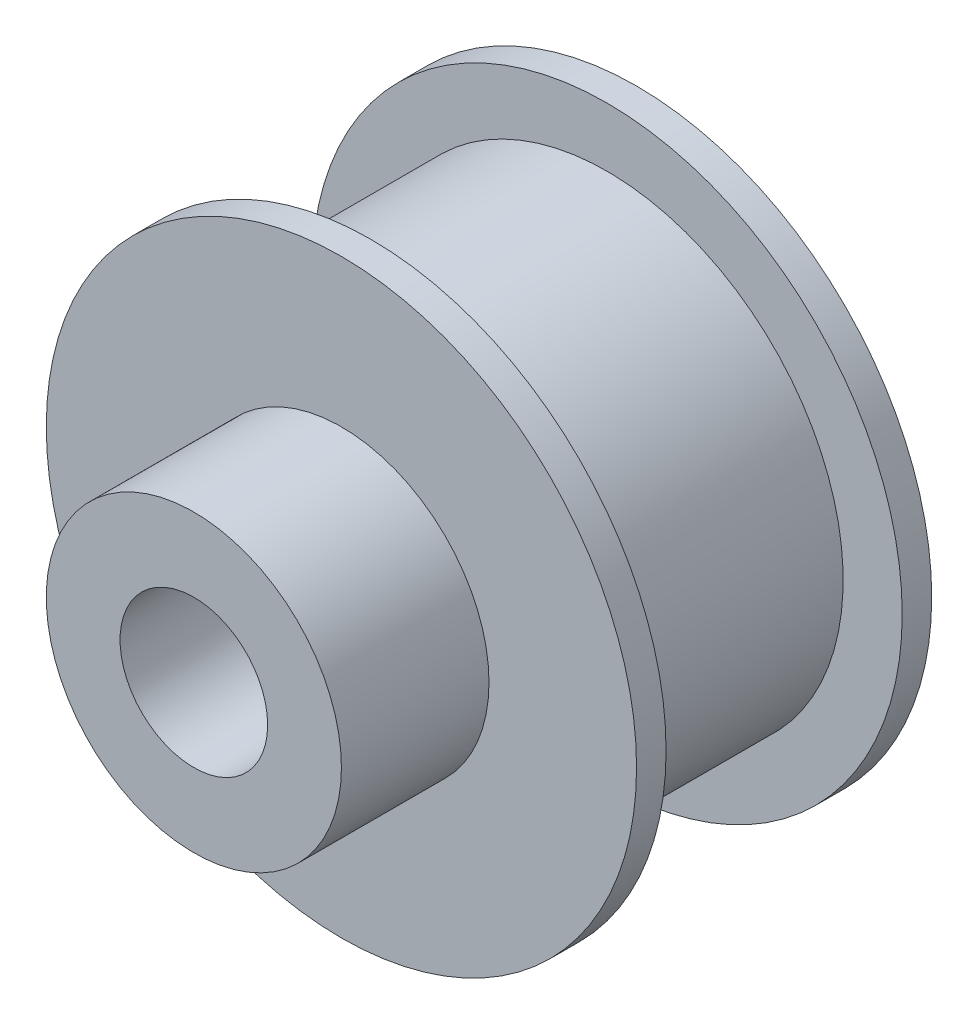
from build123d import *

# Parameters (mm, degrees)
ESQUISSE1_R             = 10
BOSS_EXTRU_1_DEPTH      = 10
ESQUISSE2_R             = 5
BOSS_EXTRU_2_DEPTH      = 5
ESQUISSE3_R             = 2.5
ENL_V_MAT_EXTRU_1_DEPTH = 21.615528128
ESQUISSE4_W             = 8
ESQUISSE4_H             = 2


with BuildPart() as part:
    # Esquisse1 → Boss.-Extru.1 (new body)
    with BuildSketch(Plane.XY):
        Circle(ESQUISSE1_R)
    extrude(amount=BOSS_EXTRU_1_DEPTH)

    # Esquisse2 → Boss.-Extru.2 (add)
    with BuildSketch(Plane.XY.offset(10)):
        Circle(ESQUISSE2_R)
    extrude(amount=BOSS_EXTRU_2_DEPTH)

    # Esquisse3 → Enlèv. mat.-Extru.1 (cut, through all)
    with BuildSketch(Plane.XY.offset(15)):
        Circle(ESQUISSE3_R)
    extrude(amount=-ENL_V_MAT_EXTRU_1_DEPTH, mode=Mode.SUBTRACT)

    # Esquisse4 → Enlèvement de matière-Révolution1 (revolve, cut)
    with BuildSketch(Plane(origin=(0, 0, 0), x_dir=(0, 0, -1), z_dir=(1, 0, 0)), mode=Mode.PRIVATE) as enl_vement_de_mati_re_r_volution1_sk:
        with Locations((-5, 9)):
            Rectangle(ESQUISSE4_W, ESQUISSE4_H)
    revolve(enl_vement_de_mati_re_r_volution1_sk.sketch.rotate(Axis((0, 0, 0), (0, 0, 1)), 90), axis=Axis((0, 0, 0), (0, 0, 1)), mode=Mode.SUBTRACT)


solid = part.part
